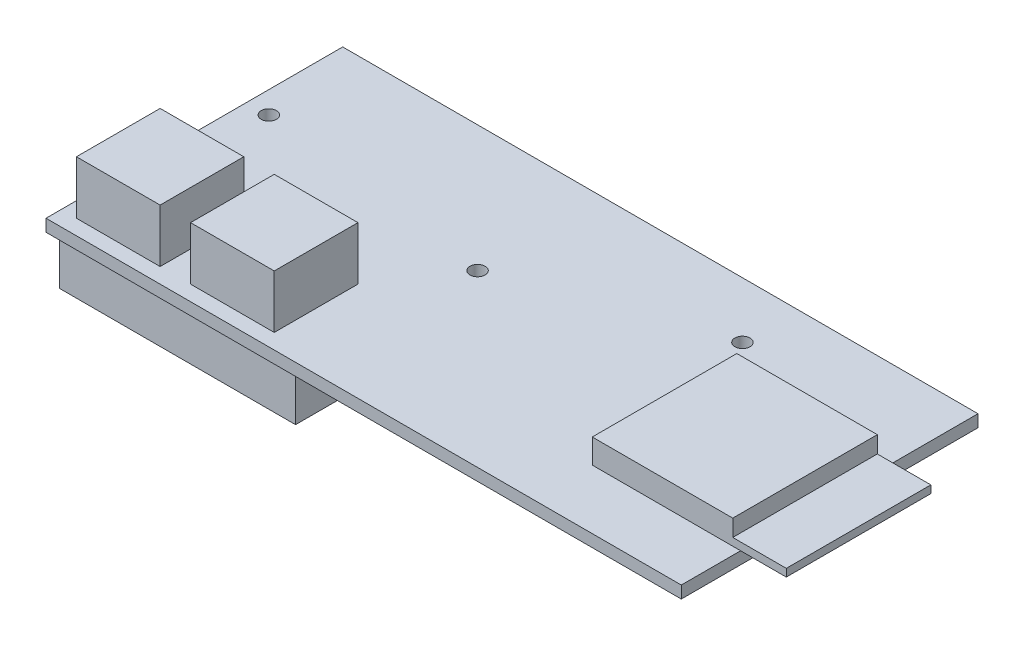
from build123d import *

# Parameters (mm, degrees)
SKETCH2_W           = 83.5
SKETCH2_H           = 39
BOSS_EXTRUDE1_DEPTH = 1.6
SKETCH3_W           = 25.5
SKETCH3_H           = 19
BOSS_EXTRUDE2_DEPTH = 1
SKETCH4_W           = 18.466737103
SKETCH4_H           = 19
BOSS_EXTRUDE3_DEPTH = 2.2
SKETCH5_R           = 1
CUT_EXTRUDE1_DEPTH  = 2.2
SKETCH6_W           = 11
SKETCH6_H           = 11
BOSS_EXTRUDE4_DEPTH = 7
SKETCH7_W           = 31
SKETCH7_H           = 15
BOSS_EXTRUDE5_DEPTH = 7.5


with BuildPart() as part:
    # Sketch2 → Boss-Extrude1 (new body)
    with BuildSketch(Plane(origin=(0, 0, 0), x_dir=(1, 0, 0), z_dir=(0, 1, 0))):
        with Locations((41.75, -19.5)):
            Rectangle(SKETCH2_W, SKETCH2_H)
    extrude(amount=BOSS_EXTRUDE1_DEPTH)

    # Sketch3 → Boss-Extrude2 (add)
    with BuildSketch(Plane(origin=(0, 1.6, 0), x_dir=(1, 0, 0), z_dir=(0, 1, 0))):
        with Locations((76.75, -21.7)):
            Rectangle(SKETCH3_W, SKETCH3_H)
    extrude(amount=BOSS_EXTRUDE2_DEPTH)

    # Sketch4 → Boss-Extrude3 (add)
    with BuildSketch(Plane(origin=(0, 2.6, 0), x_dir=(1, 0, 0), z_dir=(0, 1, 0))):
        with Locations((73.233368552, -21.7)):
            Rectangle(SKETCH4_W, SKETCH4_H)
    extrude(amount=BOSS_EXTRUDE3_DEPTH)

    # Sketch5 → Cut-Extrude1 (cut)
    with BuildSketch(Plane(origin=(0, 1.6, 0), x_dir=(1, 0, 0), z_dir=(0, 1, 0))):
        with Locations(Location((59.9, -7.36, 0), (0, 0, 270))):
            Circle(SKETCH5_R)
        with Locations(Location((34.32, -16.6, 0), (0, 0, 270))):
            Circle(SKETCH5_R)
        with Locations(Location((2.89, -12.6, 0), (0, 0, 270))):
            Circle(SKETCH5_R)
    extrude(amount=-CUT_EXTRUDE1_DEPTH, mode=Mode.SUBTRACT)

    # Sketch6 → Boss-Extrude4 (add)
    with BuildSketch(Plane(origin=(0, 1.6, 0), x_dir=(1, 0, 0), z_dir=(0, 1, 0))):
        with Locations((7.5, -31.5)):
            Rectangle(SKETCH6_W, SKETCH6_H)
        with Locations((22.5, -31.5)):
            Rectangle(SKETCH6_W, SKETCH6_H)
    extrude(amount=BOSS_EXTRUDE4_DEPTH)

    # Sketch7 → Boss-Extrude5 (add)
    with BuildSketch(Plane(origin=(0, 0, 0), x_dir=(-1, 0, 0), z_dir=(0, -1, 0))):
        with Locations((-15.3, -29.5)):
            Rectangle(SKETCH7_W, SKETCH7_H)
    extrude(amount=BOSS_EXTRUDE5_DEPTH)


solid = part.part
